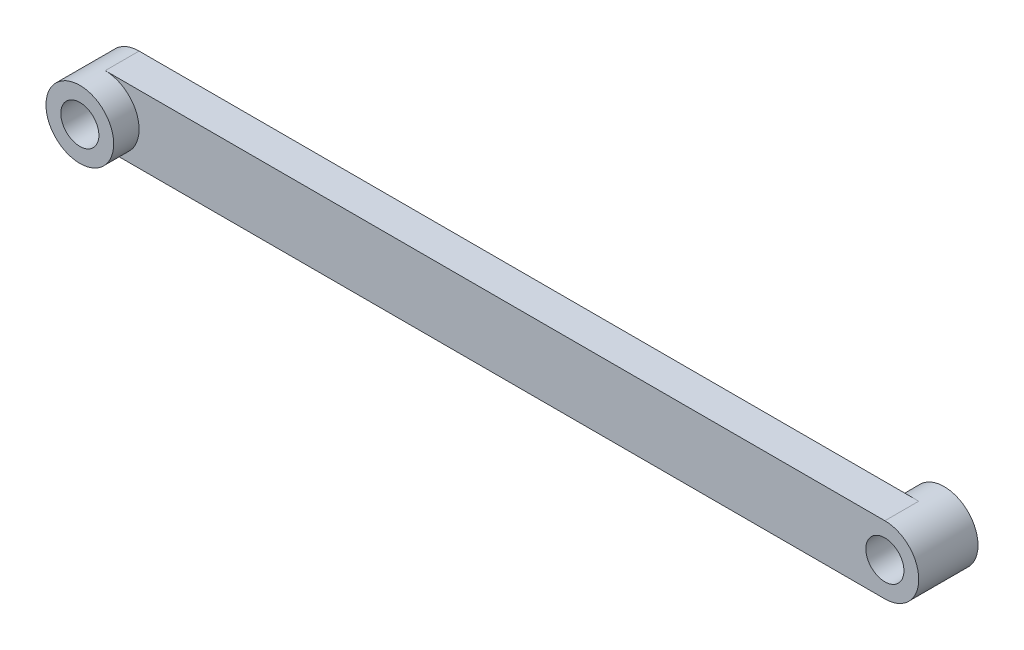
from build123d import *

# Parameters (mm, degrees)
SKETCH2_R               = 2.25
BOSS_EXTRUDE1_DEPTH     = 10
CUT_EXTRUDE_THIN1_START = -3
SKETCH3_R               = 104
SKETCH3_R_2             = 4
CUT_EXTRUDE_THIN1_DEPTH = 3
SKETCH4_R               = 104
SKETCH4_R_2             = 4
CUT_EXTRUDE_THIN2_DEPTH = 3


with BuildPart() as part:
    # Sketch2 → Boss-Extrude1 (new body)
    with BuildSketch(Plane.XY):
        with BuildLine():
            Line((0, 4), (92.1, 4))
            ThreePointArc((92.1, 4), (96.1, 0), (92.1, -4))
            Line((92.1, -4), (0, -4))
            ThreePointArc((0, -4), (-4, 0), (0, 4))
        make_face()
        Circle(SKETCH2_R, mode=Mode.SUBTRACT)
        with Locations((92.1, 0)):
            Circle(SKETCH2_R, mode=Mode.SUBTRACT)
    extrude(amount=BOSS_EXTRUDE1_DEPTH)

    # Sketch3 → Cut-Extrude-Thin1 (cut)
    with BuildSketch(Plane.XY.offset(10).offset(CUT_EXTRUDE_THIN1_START)):
        Circle(SKETCH3_R)
        Circle(SKETCH3_R_2, mode=Mode.SUBTRACT)
    extrude(amount=CUT_EXTRUDE_THIN1_DEPTH, mode=Mode.SUBTRACT)

    # Sketch4 → Cut-Extrude-Thin2 (cut)
    with BuildSketch(Plane(origin=(0, 0, 0), x_dir=(-1, 0, 0), z_dir=(0, 0, -1))):
        with Locations((-92.1, 0)):
            Circle(SKETCH4_R)
        with Locations((-92.1, 0)):
            Circle(SKETCH4_R_2, mode=Mode.SUBTRACT)
    extrude(amount=-CUT_EXTRUDE_THIN2_DEPTH, mode=Mode.SUBTRACT)


solid = part.part
